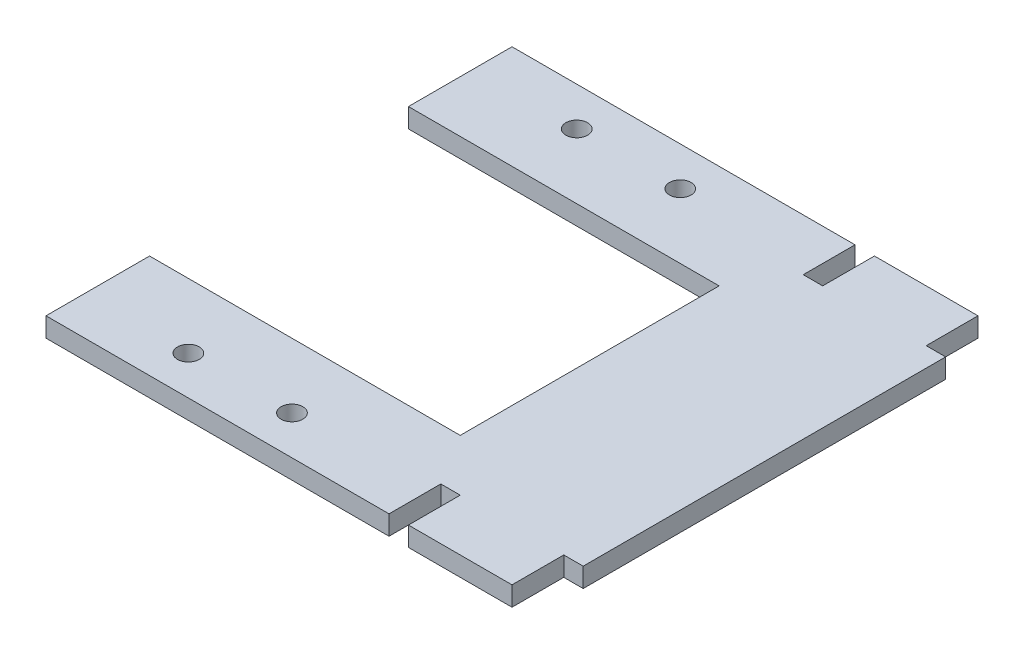
from build123d import *

# Parameters (mm, degrees)
SKETCH2_R           = 2.667
BOSS_EXTRUDE1_DEPTH = 4.7625


with BuildPart() as part:
    # Sketch2 → Boss-Extrude1 (new body)
    with BuildSketch(Plane(origin=(0, 0, 0), x_dir=(1, 0, 0), z_dir=(0, 1, 0))):
        Polygon((0, 0), (84.1375, 0), (84.1375, -12.7), (88.9, -12.7), (88.9, 0), (114.3, 0), (114.3, -12.7), (119.0625, -12.7), (119.0625, -101.6), (114.3, -101.6), (114.3, -114.3), (88.9, -114.3), (88.9, -101.6), (84.1375, -101.6), (84.1375, -114.3), (0, -114.3), (0, -88.9), (76.2, -88.9), (76.2, -25.4), (0, -25.4), align=None)
        with Locations(Location((50.8, -9.525, 0), (0, 0, 90))):
            Circle(SKETCH2_R, mode=Mode.SUBTRACT)
        with Locations(Location((25.4, -9.525, 0), (0, 0, 90))):
            Circle(SKETCH2_R, mode=Mode.SUBTRACT)
        with Locations(Location((50.8, -104.775, 0), (0, 0, 90))):
            Circle(SKETCH2_R, mode=Mode.SUBTRACT)
        with Locations(Location((25.4, -104.775, 0), (0, 0, 90))):
            Circle(SKETCH2_R, mode=Mode.SUBTRACT)
    extrude(amount=BOSS_EXTRUDE1_DEPTH)


solid = part.part
